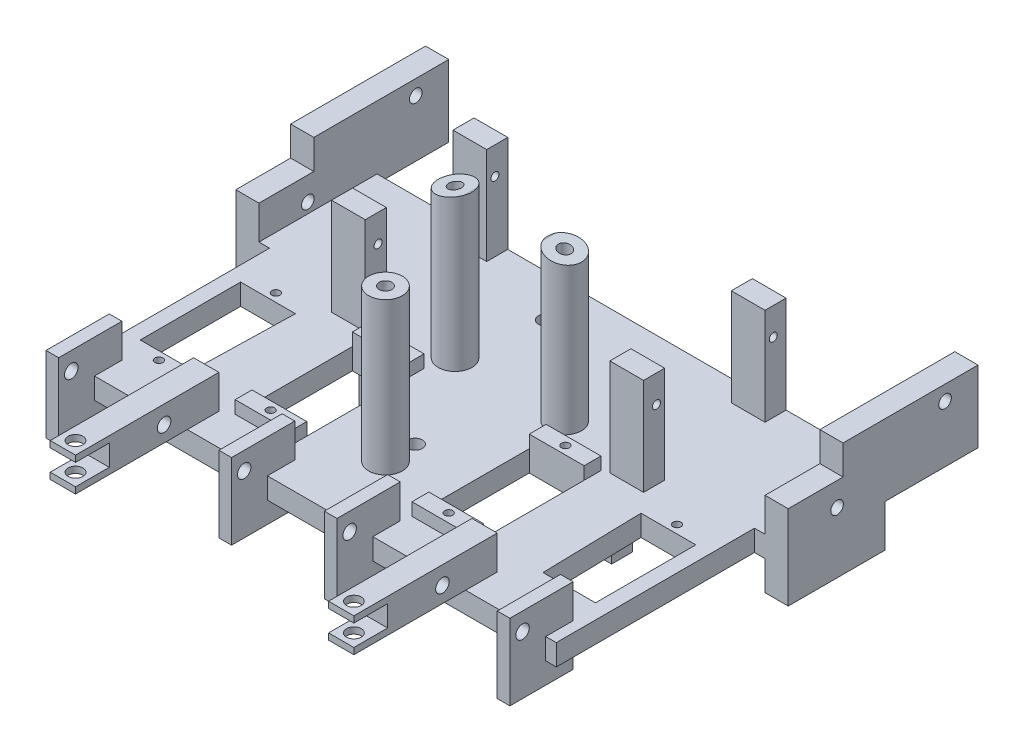
from build123d import *

# Parameters (mm, degrees)
SKETCH_1_W           = 115
SKETCH_1_H           = 75
EXTRUDE_1_DEPTH      = 5
SKETCH_4_W           = 120
SKETCH_4_H           = 28
EXTRUDE_4_DEPTH      = 5
SKETCH_5_W           = 23
SKETCH_5_H           = 20
EXTRUDE_5_DEPTH      = 5.5
SKETCH_6_W           = 32
SKETCH_6_H           = 17
EXTRUDE_6_DEPTH      = 5.5
SKETCH_8_W           = 8
SKETCH_8_H           = 5
EXTRUDE_7_DEPTH      = 23
EXTRUDE_START        = -10
SKETCH_9_W           = 3
SKETCH_9_H           = 15
EXTRUDE_8_DEPTH      = 18
SKETCH_10_W          = 3
SKETCH_10_H          = 15
EXTRUDE_9_DEPTH      = 18
SKETCH_11_W          = 6
SKETCH_11_H          = 34
EXTRUDE_10_DEPTH     = 8
SKETCH_12_R          = 4
EXTRUDE_11_DEPTH     = 36
CUT_EXTRUDE_8_REACH  = 125.231
SKETCH_19_R          = 0.95
SKETCH_25_R          = 4
EXTRUDE_14_DEPTH     = 36
CUT_EXTRUDE_14_DEPTH = 36
SKETCH_28_W          = 6
SKETCH_28_H          = 5
CUT_EXTRUDE_16_DEPTH = 8
SKETCH_29_R          = 1.75
CUT_EXTRUDE_17_DEPTH = 8
SKETCH_30_R          = 1.6
CUT_EXTRUDE_18_DEPTH = 48
SKETCH_31_R          = 1.75
CUT_EXTRUDE_19_DEPTH = 20
SKETCH_35_R          = 1.5
CUT_EXTRUDE_23_DEPTH = 15
SKETCH_36_R          = 0.95
SKETCH_36_W          = 13
SKETCH_36_H          = 23.8
CUT_EXTRUDE_24_DEPTH = 7
SKETCH_37_W          = 6
SKETCH_37_H          = 5
EXTRUDE_15_DEPTH     = 13
SKETCH_38_R          = 0.95
CUT_EXTRUDE_25_DEPTH = 13
SKETCH_43_W          = 38
SKETCH_43_H          = 36.317543969
SKETCH_43_W_2        = 6
SKETCH_43_H_2        = 5
CUT_EXTRUDE_28_DEPTH = 2
EXTRUDE_START_2      = 3
SKETCH_41_W          = 13
SKETCH_41_H          = 4
SKETCH_41_R          = 0.95
EXTRUDE_16_DEPTH     = 3
CUT_EXTRUDE_START    = -13
SKETCH_39_R          = 1.5
CUT_EXTRUDE_26_DEPTH = 55


with BuildPart() as part:
    # 草图1 → 凸台-拉伸1 (new body)
    with BuildSketch(Plane(origin=(0, 0, 0), x_dir=(1, 0, 0), z_dir=(0, 1, 0))):
        Rectangle(SKETCH_1_W, SKETCH_1_H)
    extrude(amount=EXTRUDE_1_DEPTH)

    # 草图4 → 凸台-拉伸4 (add)
    with BuildSketch(Plane(origin=(0, 5, 0), x_dir=(1, 0, 0), z_dir=(0, 1, 0))):
        with Locations((0, 23.5)):
            Rectangle(SKETCH_4_W, SKETCH_4_H)
    extrude(amount=-EXTRUDE_4_DEPTH)

    # 草图5 → 凸台-拉伸5 (add)
    with BuildSketch(Plane.ZY.offset(60)):
        with Locations((-21, 3)):
            Rectangle(SKETCH_5_W, SKETCH_5_H)
    extrude_5 = extrude(amount=EXTRUDE_5_DEPTH)

    # 草图6 → 凸台-拉伸6 (add)
    with BuildSketch(Plane.ZY.offset(60)):
        with Locations((-38.5, 11.5)):
            Rectangle(SKETCH_6_W, SKETCH_6_H)
    extrude_6 = extrude(amount=EXTRUDE_6_DEPTH)

    # 草图8 → 凸台-拉伸7 (add)
    with BuildSketch(Plane(origin=(0, 5, 0), x_dir=(1, 0, 0), z_dir=(0, 1, 0))):
        with Locations((-33, 35)):
            Rectangle(SKETCH_8_W, SKETCH_8_H)
        with Locations((-33, 6.2)):
            Rectangle(SKETCH_8_W, SKETCH_8_H)
    extrude_7 = extrude(amount=EXTRUDE_7_DEPTH)

    # 草图9 → 凸台-拉伸8 (add)
    with BuildSketch(Plane(origin=(0, 5, 0), x_dir=(1, 0, 0), z_dir=(0, 1, 0)).offset(EXTRUDE_START)):
        with Locations((-12.5, -38.5)):
            Rectangle(SKETCH_9_W, SKETCH_9_H)
    extrude_8 = extrude(amount=EXTRUDE_8_DEPTH)

    # 草图10 → 凸台-拉伸9 (add)
    with BuildSketch(Plane(origin=(0, 5, 0), x_dir=(1, 0, 0), z_dir=(0, 1, 0)).offset(EXTRUDE_START)):
        with Locations((-53.5, -38.5)):
            Rectangle(SKETCH_10_W, SKETCH_10_H)
    extrude_9 = extrude(amount=EXTRUDE_9_DEPTH)

    # 草图11 → 凸台-拉伸10 (add)
    with BuildSketch(Plane(origin=(0, 5, 0), x_dir=(1, 0, 0), z_dir=(0, 1, 0))):
        with Locations((-33, -47)):
            Rectangle(SKETCH_11_W, SKETCH_11_H)
    extrude_10 = extrude(amount=EXTRUDE_10_DEPTH)

    # 草图12 → 凸台-拉伸11 (add)
    with BuildSketch(Plane(origin=(0, 5, 0), x_dir=(1, 0, 0), z_dir=(0, 1, 0))):
        with Locations(Location((-13, 9, 0), (0, 0, 270))):
            Circle(SKETCH_12_R)
    extrude_11 = extrude(amount=EXTRUDE_11_DEPTH)

    # 草图19 → 切除-拉伸8 (cut, up to next)
    with BuildSketch(Plane.ZY.offset(37), mode=Mode.PRIVATE) as cut_extrude_8_sk1:
        with Locations((-6.75, 21.5)):
            Circle(SKETCH_19_R)
    cut_extrude_8_tool1 = extrude(cut_extrude_8_sk1.sketch, amount=-CUT_EXTRUDE_8_REACH, mode=Mode.PRIVATE) & part.part
    # 草图19 → 切除-拉伸8 (cut, up to next)
    with BuildSketch(Plane.ZY.offset(37), mode=Mode.PRIVATE) as cut_extrude_8_sk2:
        with Locations((-34.45, 21.5)):
            Circle(SKETCH_19_R)
    cut_extrude_8_tool2 = extrude(cut_extrude_8_sk2.sketch, amount=-CUT_EXTRUDE_8_REACH, mode=Mode.PRIVATE) & part.part
    cut_extrude_8_1 = cut_extrude_8_tool1.solids().sort_by_distance((-37, 21.5, -6.75))[0]
    add(cut_extrude_8_1, mode=Mode.SUBTRACT)
    cut_extrude_8_2 = cut_extrude_8_tool2.solids().sort_by_distance((-37, 21.5, -34.45))[0]
    add(cut_extrude_8_2, mode=Mode.SUBTRACT)
    cut_extrude_8 = cut_extrude_8_1 + cut_extrude_8_2  # 切除-拉伸8 as one shape, for the pattern or mirror that repeats it

    # 草图25 → 凸台-拉伸14 (add)
    with BuildSketch(Plane(origin=(0, 5, 0), x_dir=(1, 0, 0), z_dir=(0, 1, 0))):
        with Locations(Location((0, -20.5, 0), (0, 0, 270))):
            Circle(SKETCH_25_R)
    extrude(amount=EXTRUDE_14_DEPTH)

    # 草图26 → 切除-拉伸14 (cut)
    with BuildSketch(Plane.XY):
        Polygon((-17, 41), (-17, 39.644045518), (-9.31, 41), align=None)
    cut_extrude_14 = extrude(amount=-CUT_EXTRUDE_14_DEPTH, mode=Mode.SUBTRACT)

    # 草图28 → 切除-拉伸16 (cut)
    with BuildSketch(Plane.XY.offset(64)):
        with Locations((-33, 9)):
            Rectangle(SKETCH_28_W, SKETCH_28_H)
    cut_extrude_16 = extrude(amount=-CUT_EXTRUDE_16_DEPTH, mode=Mode.SUBTRACT)

    # 草图29 → 切除-拉伸17 (cut)
    with BuildSketch(Plane(origin=(0, 13, 0), x_dir=(1, 0, 0), z_dir=(0, 1, 0))):
        with Locations(Location((-33, -61, 0), (0, 0, 270))):
            Circle(SKETCH_29_R)
    cut_extrude_17 = extrude(amount=-CUT_EXTRUDE_17_DEPTH, mode=Mode.SUBTRACT)

    # 草图30 → 切除-拉伸18 (cut)
    with BuildSketch(Plane.ZY.offset(55)):
        with Locations((43, 8.75)):
            Circle(SKETCH_30_R)
    cut_extrude_18 = extrude(amount=-CUT_EXTRUDE_18_DEPTH, mode=Mode.SUBTRACT)

    # 草图31 → 切除-拉伸19 (cut)
    with BuildSketch(Plane(origin=(0, 5, 0), x_dir=(1, 0, 0), z_dir=(0, 1, 0))):
        with Locations(Location((0, -13.5, 0), (0, 0, 270))):
            Circle(SKETCH_31_R)
        with Locations(Location((-10, 27.5, 0), (0, 0, 270))):
            Circle(SKETCH_31_R)
        with Locations(Location((10, 27.5, 0), (0, 0, 270))):
            Circle(SKETCH_31_R)
    extrude(amount=-CUT_EXTRUDE_19_DEPTH, mode=Mode.SUBTRACT)

    # 草图35 → 切除-拉伸23 (cut)
    with BuildSketch(Plane.ZY.offset(65.5)):
        with Locations((-46.688415906, 16.452713274)):
            Circle(SKETCH_35_R)
        with Locations((-21.089366767, 7.437765567)):
            Circle(SKETCH_35_R)
    cut_extrude_23 = extrude(amount=-CUT_EXTRUDE_23_DEPTH, mode=Mode.SUBTRACT)

    # 草图36 → 切除-拉伸24 (cut)
    with BuildSketch(Plane(origin=(0, 5, 0), x_dir=(1, 0, 0), z_dir=(0, 1, 0))):
        with Locations(Location((-21.107931352, 1.06968667, 0), (0, 0, 270))):
            Circle(SKETCH_36_R)
        with Locations(Location((-21.107931352, -26.63031333, 0), (0, 0, 270))):
            Circle(SKETCH_36_R)
        with Locations(Location((-47.60881077, -26.63031333, 0), (0, 0, 270))):
            Circle(SKETCH_36_R)
        with Locations(Location((-47.559743394, 1.06968667, 0), (0, 0, 270))):
            Circle(SKETCH_36_R)
        with Locations((-20.972977651, -12.78031333)):
            Rectangle(SKETCH_36_W, SKETCH_36_H)
        Polygon((-40.973854239, -0.88031333), (-41.53606508, -24.68031333), (-53.973854239, -24.68031333), (-53.973854239, -0.88031333), align=None)
    cut_extrude_24 = extrude(amount=-CUT_EXTRUDE_24_DEPTH, mode=Mode.SUBTRACT)

    # 草图37 → 凸台-拉伸15 (add)
    with BuildSketch(Plane.XZ):
        with Locations((-26.934633868, -34.482456031)):
            Rectangle(SKETCH_37_W, SKETCH_37_H)
        with Locations((-26.934633868, -5.682456031)):
            Rectangle(SKETCH_37_W, SKETCH_37_H)
    extrude_15 = extrude(amount=EXTRUDE_15_DEPTH)

    # 草图38 → 切除-拉伸25 (cut)
    with BuildSketch(Plane.ZY.offset(29.934633868)):
        with Locations((-33.932456031, -4.5)):
            Circle(SKETCH_38_R)
        with Locations((-6.232456031, -4.5)):
            Circle(SKETCH_38_R)
    cut_extrude_25 = extrude(amount=-CUT_EXTRUDE_25_DEPTH, mode=Mode.SUBTRACT)

    # 草图43 → 切除-拉伸28 (cut)
    with BuildSketch(Plane.XZ):
        with Locations((-34.934633868, -19.341228016)):
            Rectangle(SKETCH_43_W, SKETCH_43_H)
        with Locations((-26.934633868, -5.682456031)):
            Rectangle(SKETCH_43_W_2, SKETCH_43_H_2, mode=Mode.SUBTRACT)
        with Locations((-26.934633868, -34.482456031)):
            Rectangle(SKETCH_43_W_2, SKETCH_43_H_2, mode=Mode.SUBTRACT)
    cut_extrude_28 = extrude(amount=-CUT_EXTRUDE_28_DEPTH, mode=Mode.SUBTRACT)

    # 草图41 → 凸台-拉伸16 (add)
    # profile 1 of 2: a face of its own
    with BuildSketch(Plane(origin=(0, 5, 0), x_dir=(1, 0, 0), z_dir=(0, 1, 0)).offset(EXTRUDE_START_2)):
        with Locations((-20.972977651, 1.11968667)):
            Rectangle(SKETCH_41_W, SKETCH_41_H)
        with Locations(Location((-21.107931352, 1.06968667, 0), (0, 0, 270))):
            Circle(SKETCH_41_R, mode=Mode.SUBTRACT)
    # profile 2 of 2: a face of its own
    with BuildSketch(Plane(origin=(0, 5, 0), x_dir=(1, 0, 0), z_dir=(0, 1, 0)).offset(EXTRUDE_START_2)):
        with Locations((-20.972977651, -26.68031333)):
            Rectangle(SKETCH_41_W, SKETCH_41_H)
        with Locations(Location((-21.107931352, -26.63031333, 0), (0, 0, 270))):
            Circle(SKETCH_41_R, mode=Mode.SUBTRACT)
    extrude_16 = extrude(amount=-EXTRUDE_16_DEPTH)

    # 草图39 → 切除-拉伸26 (cut)
    with BuildSketch(Plane(origin=(0, 5, 0), x_dir=(1, 0, 0), z_dir=(0, 1, 0)).offset(CUT_EXTRUDE_START)):
        with Locations(Location((-13, 9, 0), (0, 0, 180))):
            Circle(SKETCH_39_R)
        with Locations(Location((0, -20.5, 0), (0, 0, 270))):
            Circle(SKETCH_39_R)
    cut_extrude_26 = extrude(amount=CUT_EXTRUDE_26_DEPTH, mode=Mode.SUBTRACT)

    # 镜向1: 凸台-拉伸5, 凸台-拉伸6, 凸台-拉伸7, 凸台-拉伸8, 凸台-拉伸9, 凸台-拉伸10, 凸台-拉伸11, 切除-拉伸8, 切除-拉伸14, 切除-拉伸16, 切除-拉伸17, 切除-拉伸18, 切除-拉伸23, 切除-拉伸24, 凸台-拉伸15, 切除-拉伸25, 切除-拉伸28, 凸台-拉伸16, 切除-拉伸26 across plane
    add(extrude_5.mirror(Plane(origin=(0, 0, 0), x_dir=(0, 0, 1), z_dir=(1, 0, 0))))
    add(extrude_6.mirror(Plane(origin=(0, 0, 0), x_dir=(0, 0, 1), z_dir=(1, 0, 0))))
    add(extrude_7.mirror(Plane(origin=(0, 0, 0), x_dir=(0, 0, 1), z_dir=(1, 0, 0))))
    add(extrude_8.mirror(Plane(origin=(0, 0, 0), x_dir=(0, 0, 1), z_dir=(1, 0, 0))))
    add(extrude_9.mirror(Plane(origin=(0, 0, 0), x_dir=(0, 0, 1), z_dir=(1, 0, 0))))
    add(extrude_10.mirror(Plane(origin=(0, 0, 0), x_dir=(0, 0, 1), z_dir=(1, 0, 0))))
    add(extrude_11.mirror(Plane(origin=(0, 0, 0), x_dir=(0, 0, 1), z_dir=(1, 0, 0))))
    add(cut_extrude_8.mirror(Plane(origin=(0, 0, 0), x_dir=(0, 0, 1), z_dir=(1, 0, 0))), mode=Mode.SUBTRACT)
    add(cut_extrude_14.mirror(Plane(origin=(0, 0, 0), x_dir=(0, 0, 1), z_dir=(1, 0, 0))), mode=Mode.SUBTRACT)
    add(cut_extrude_16.mirror(Plane(origin=(0, 0, 0), x_dir=(0, 0, 1), z_dir=(1, 0, 0))), mode=Mode.SUBTRACT)
    add(cut_extrude_17.mirror(Plane(origin=(0, 0, 0), x_dir=(0, 0, 1), z_dir=(1, 0, 0))), mode=Mode.SUBTRACT)
    add(cut_extrude_18.mirror(Plane(origin=(0, 0, 0), x_dir=(0, 0, 1), z_dir=(1, 0, 0))), mode=Mode.SUBTRACT)
    add(cut_extrude_23.mirror(Plane(origin=(0, 0, 0), x_dir=(0, 0, 1), z_dir=(1, 0, 0))), mode=Mode.SUBTRACT)
    add(cut_extrude_24.mirror(Plane(origin=(0, 0, 0), x_dir=(0, 0, 1), z_dir=(1, 0, 0))), mode=Mode.SUBTRACT)
    add(extrude_15.mirror(Plane(origin=(0, 0, 0), x_dir=(0, 0, 1), z_dir=(1, 0, 0))))
    add(cut_extrude_25.mirror(Plane(origin=(0, 0, 0), x_dir=(0, 0, 1), z_dir=(1, 0, 0))), mode=Mode.SUBTRACT)
    add(cut_extrude_28.mirror(Plane(origin=(0, 0, 0), x_dir=(0, 0, 1), z_dir=(1, 0, 0))), mode=Mode.SUBTRACT)
    add(extrude_16.mirror(Plane(origin=(0, 0, 0), x_dir=(0, 0, 1), z_dir=(1, 0, 0))))
    add(cut_extrude_26.mirror(Plane(origin=(0, 0, 0), x_dir=(0, 0, 1), z_dir=(1, 0, 0))), mode=Mode.SUBTRACT)


solid = part.part
